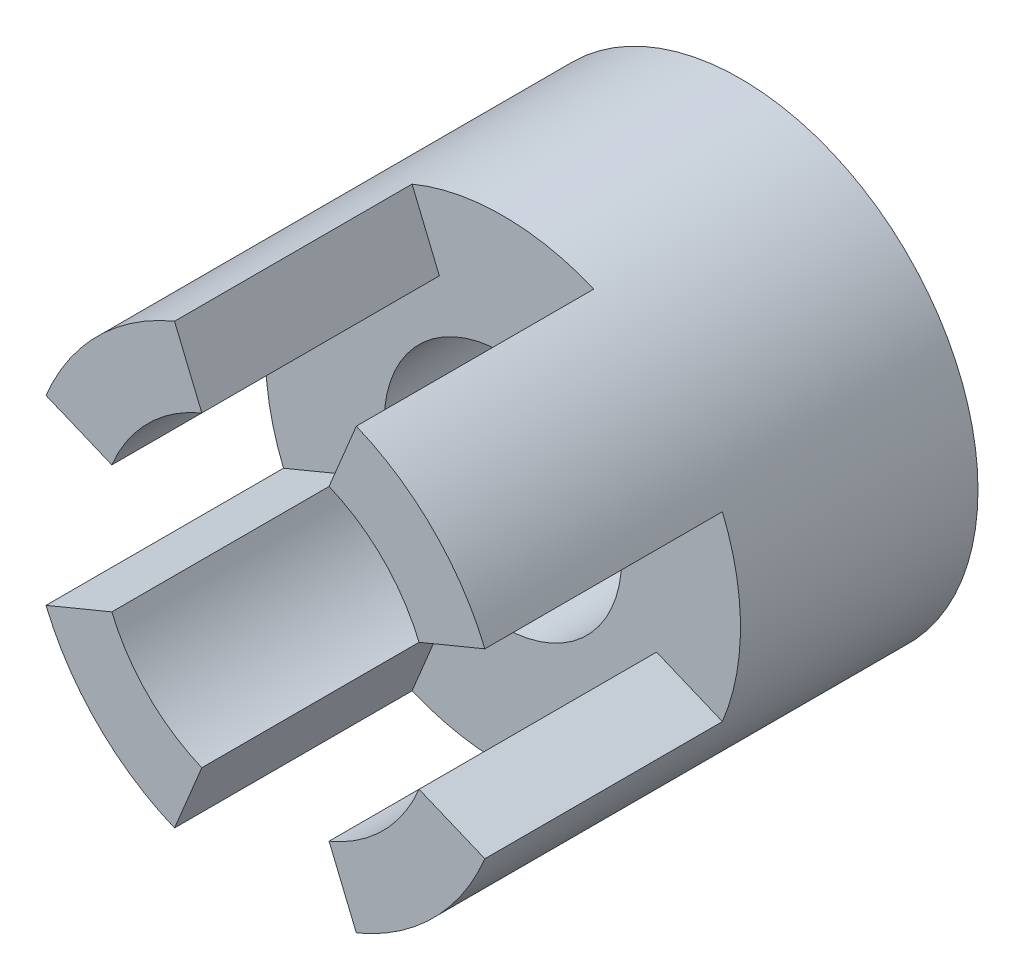
from build123d import *

# Parameters (mm, degrees)
SKETCH_1_R          = 10
SKETCH_1_R_2        = 5
EXTRUDE_1_DEPTH     = 10
SKETCH_2_R          = 10
SKETCH_2_R_2        = 4
EXTRUDE_2_DEPTH     = 10
CUT_EXTRUDE_START   = -10
CUT_EXTRUDE_1_DEPTH = 10
SKETCH_4_R          = 7
CUT_EXTRUDE_2_DEPTH = 10


with BuildPart() as part:
    # 草图1 → 凸台-拉伸1 (new body)
    with BuildSketch(Plane.XY):
        Circle(SKETCH_1_R)
        Circle(SKETCH_1_R_2, mode=Mode.SUBTRACT)
    extrude(amount=EXTRUDE_1_DEPTH)

    # 草图2 → 凸台-拉伸2 (add)
    with BuildSketch(Plane.XY.offset(10)):
        Circle(SKETCH_2_R)
        Circle(SKETCH_2_R_2, mode=Mode.SUBTRACT)
    extrude(amount=EXTRUDE_2_DEPTH)

    # 草图3 → 切除-拉伸1 (cut)
    with BuildSketch(Plane.XY.offset(20).offset(CUT_EXTRUDE_START)):
        with BuildLine():
            Line((2.678784027, 6.467156728), (3.826834324, 9.238795325))
            ThreePointArc((3.826834324, 9.238795325), (0, 10), (-3.826834324, 9.238795325))
            Line((-3.826834324, 9.238795325), (-2.678784027, 6.467156728))
            ThreePointArc((-2.678784027, 6.467156728), (0, 7), (2.678784027, 6.467156728))
        make_face()
        with BuildLine():
            ThreePointArc((10, 0), (9.807852804, 1.95090322), (9.238795325, 3.826834324))
            Line((9.238795325, 3.826834324), (6.467156728, 2.678784027))
            ThreePointArc((6.467156728, 2.678784027), (7, 0), (6.467156728, -2.678784027))
            Line((6.467156728, -2.678784027), (9.238795325, -3.826834324))
            ThreePointArc((9.238795325, -3.826834324), (9.807852804, -1.95090322), (10, 0))
        make_face()
        with BuildLine():
            Line((-2.678784027, -6.467156728), (-3.826834324, -9.238795325))
            ThreePointArc((-3.826834324, -9.238795325), (0, -10), (3.826834324, -9.238795325))
            Line((3.826834324, -9.238795325), (2.678784027, -6.467156728))
            ThreePointArc((2.678784027, -6.467156728), (0, -7), (-2.678784027, -6.467156728))
        make_face()
        with BuildLine():
            Line((-6.467156728, 2.678784027), (-9.238795325, 3.826834324))
            ThreePointArc((-9.238795325, 3.826834324), (-10, 0), (-9.238795325, -3.826834324))
            Line((-9.238795325, -3.826834324), (-6.467156728, -2.678784027))
            ThreePointArc((-6.467156728, -2.678784027), (-7, 0), (-6.467156728, 2.678784027))
        make_face()
    extrude(amount=CUT_EXTRUDE_1_DEPTH, mode=Mode.SUBTRACT)

    # 草图4 → 切除-拉伸2 (cut)
    with BuildSketch(Plane.XY.offset(20).offset(CUT_EXTRUDE_START)):
        Circle(SKETCH_4_R)
    extrude(amount=CUT_EXTRUDE_2_DEPTH, mode=Mode.SUBTRACT)


solid = part.part
